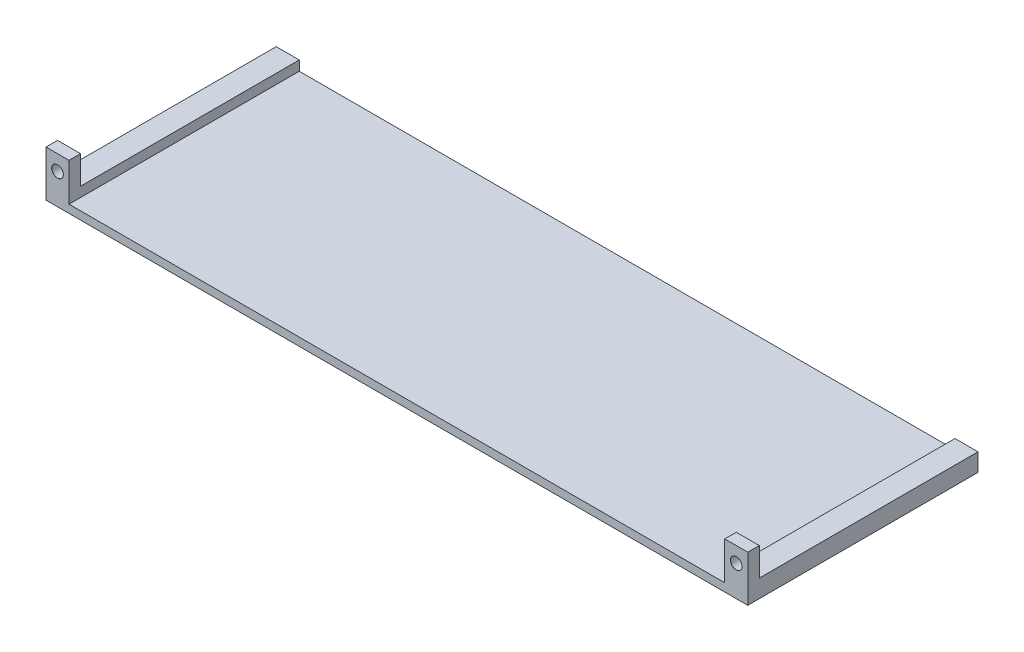
from build123d import *

# Parameters (mm, degrees)
SKETCH1_W                       = 10
SKETCH1_H                       = 16.5
BOSS_EXTRUDE1_DEPTH             = 100
F_5_0MM_DOWEL_HOLE3_D           = 5
F_5_0MM_DOWEL_HOLE3_DEPTH       = 100
F_5_0MM_DOWEL_HOLE3_CSINK_D     = 5.05
F_5_0MM_DOWEL_HOLE3_CSINK_ANGLE = 90
F_5_0MM_DOWEL_HOLE3_TIP         = 1.502151548
SKETCH8_R                       = 2.5
BOSS_EXTRUDE2_DEPTH             = 100
SKETCH11_W                      = 7.604101256
SKETCH11_H                      = 6.322975501
BOSS_EXTRUDE3_DEPTH             = 10
SKETCH10_W                      = 95
SKETCH10_H                      = 12.25
CUT_EXTRUDE3_DEPTH              = 10
SKETCH12_W                      = 7.319773992
SKETCH12_H                      = 6.84369113
BOSS_EXTRUDE4_DEPTH             = 5


with BuildPart() as part:
    # Sketch1 → Boss-Extrude1 (new body)
    with BuildSketch(Plane.XY):
        Polygon((-152.4, -40.74), (-142.4, -40.74), (-142.4, -24.24), (-152.4, -24.24), (-152.4, -24.840528939), align=None)
        Polygon((0, -44.24), (0, -40.74), (-142.4, -40.74), (-152.4, -40.74), (-152.4, -44.24), align=None)
        Polygon((142.4, -40.74), (0, -40.74), (0, -44.24), (152.4, -44.24), (152.4, -40.74), align=None)
        with Locations((147.4, -32.49)):
            Rectangle(SKETCH1_W, SKETCH1_H)
    extrude(amount=-BOSS_EXTRUDE1_DEPTH)

    # Ø5.0mm Dowel Hole3
    with Locations(Plane.XY):
        with Locations((-147.4, -30.906666667), (-147.4, -37.573333333), (147.4, -30.906666667), (147.4, -37.573333333)):
            CounterSinkHole(F_5_0MM_DOWEL_HOLE3_D / 2, F_5_0MM_DOWEL_HOLE3_CSINK_D / 2, depth=F_5_0MM_DOWEL_HOLE3_DEPTH, counter_sink_angle=F_5_0MM_DOWEL_HOLE3_CSINK_ANGLE)
            with Locations((0, 0, -(F_5_0MM_DOWEL_HOLE3_DEPTH + F_5_0MM_DOWEL_HOLE3_TIP / 2))):  # 118° drill point
                Cone(0, F_5_0MM_DOWEL_HOLE3_D / 2, F_5_0MM_DOWEL_HOLE3_TIP, mode=Mode.SUBTRACT)

    # Sketch8 → Boss-Extrude2 (add)
    with BuildSketch(Plane(origin=(0, 0, -100), x_dir=(-1, 0, 0), z_dir=(0, 0, -1))):
        with Locations((147.4, -37.573333333)):
            Circle(SKETCH8_R)
    boss_extrude2 = extrude(amount=-BOSS_EXTRUDE2_DEPTH)

    # Sketch11 → Boss-Extrude3 (add)
    with BuildSketch(Plane.XY):
        with Locations((-147.317312743, -37.707651596)):
            Rectangle(SKETCH11_W, SKETCH11_H)
    extrude(amount=-BOSS_EXTRUDE3_DEPTH)

    # Mirror4: Boss-Extrude2 across plane
    add(boss_extrude2.mirror(Plane(origin=(0, 0, 0), x_dir=(0, 0, 1), z_dir=(1, 0, 0))))

    # Sketch10 → Cut-Extrude3 (cut)
    with BuildSketch(Plane(origin=(152.4, 0, 0), x_dir=(0, 0, -1), z_dir=(1, 0, 0))):
        with Locations((52.5, -30.365)):
            Rectangle(SKETCH10_W, SKETCH10_H)
    cut_extrude3 = extrude(amount=-CUT_EXTRUDE3_DEPTH, mode=Mode.SUBTRACT)

    # Mirror5: Cut-Extrude3 across plane
    add(cut_extrude3.mirror(Plane(origin=(0, 0, 0), x_dir=(0, 0, 1), z_dir=(1, 0, 0))), mode=Mode.SUBTRACT)

    # Sketch12 → Boss-Extrude4 (add)
    with BuildSketch(Plane.XY):
        with Locations((147.557359199, -37.793735485)):
            Rectangle(SKETCH12_W, SKETCH12_H)
    extrude(amount=-BOSS_EXTRUDE4_DEPTH)


solid = part.part
